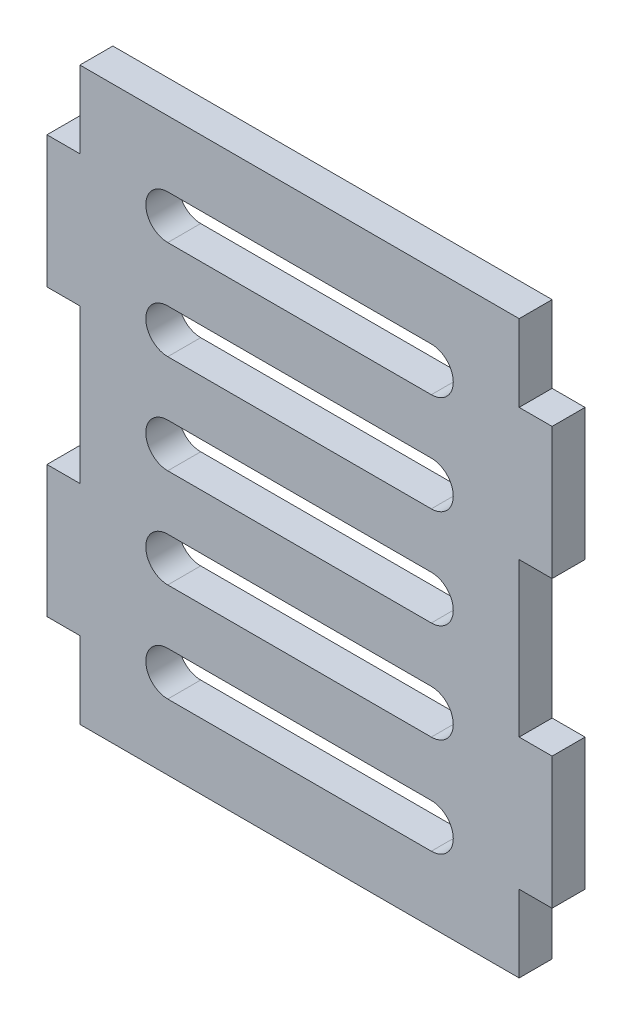
from build123d import *

# Parameters (mm, degrees)
SKETCH1_W        = 20
SKETCH1_H        = 26
BASE_DEPTH       = 1.5
SKETCH3_W        = 1.5
SKETCH3_H        = 6
MOUNT_EARS_DEPTH = 1.5
RIBS_REACH       = 47.875


with BuildPart() as part:
    # Sketch1 → Base (new body)
    with BuildSketch(Plane.XY):
        with Locations((10, 27.497191913)):
            Rectangle(SKETCH1_W, SKETCH1_H)
    extrude(amount=BASE_DEPTH)

    # Sketch3 → Mount ears (add)
    with BuildSketch(Plane.XY.offset(1.5)):
        with Locations((-0.75, 33.997191913)):
            Rectangle(SKETCH3_W, SKETCH3_H)
        with Locations((20.75, 33.997191913)):
            Rectangle(SKETCH3_W, SKETCH3_H)
        with Locations((20.75, 20.997191913)):
            Rectangle(SKETCH3_W, SKETCH3_H)
        with Locations((-0.75, 20.997191913)):
            Rectangle(SKETCH3_W, SKETCH3_H)
    extrude(amount=-MOUNT_EARS_DEPTH)

    # Sketch5 → Ribs (cut, up to next)
    with BuildSketch(Plane.XY.offset(1.5), mode=Mode.PRIVATE) as ribs_sk1:
        with BuildLine():
            Line((4, 37.497191913), (16, 37.497191913))
            ThreePointArc((16, 37.497191913), (17, 36.497191913), (16, 35.497191913))
            Line((16, 35.497191913), (4, 35.497191913))
            ThreePointArc((4, 35.497191913), (3, 36.497191913), (4, 37.497191913))
        make_face()
    ribs_tool1 = extrude(ribs_sk1.sketch, amount=-RIBS_REACH, mode=Mode.PRIVATE) & part.part
    # Sketch5 → Ribs (cut, up to next)
    with BuildSketch(Plane.XY.offset(1.5), mode=Mode.PRIVATE) as ribs_sk2:
        with BuildLine():
            Line((4, 32.997191913), (16, 32.997191913))
            ThreePointArc((16, 32.997191913), (17, 31.997191913), (16, 30.997191913))
            Line((16, 30.997191913), (4, 30.997191913))
            ThreePointArc((4, 30.997191913), (3, 31.997191913), (4, 32.997191913))
        make_face()
    ribs_tool2 = extrude(ribs_sk2.sketch, amount=-RIBS_REACH, mode=Mode.PRIVATE) & part.part
    # Sketch5 → Ribs (cut, up to next)
    with BuildSketch(Plane.XY.offset(1.5), mode=Mode.PRIVATE) as ribs_sk3:
        with BuildLine():
            Line((4, 28.497191913), (16, 28.497191913))
            ThreePointArc((16, 28.497191913), (17, 27.497191913), (16, 26.497191913))
            Line((16, 26.497191913), (4, 26.497191913))
            ThreePointArc((4, 26.497191913), (3, 27.497191913), (4, 28.497191913))
        make_face()
    ribs_tool3 = extrude(ribs_sk3.sketch, amount=-RIBS_REACH, mode=Mode.PRIVATE) & part.part
    # Sketch5 → Ribs (cut, up to next)
    with BuildSketch(Plane.XY.offset(1.5), mode=Mode.PRIVATE) as ribs_sk4:
        with BuildLine():
            Line((4, 23.997191913), (16, 23.997191913))
            ThreePointArc((16, 23.997191913), (17, 22.997191913), (16, 21.997191913))
            Line((16, 21.997191913), (4, 21.997191913))
            ThreePointArc((4, 21.997191913), (3, 22.997191913), (4, 23.997191913))
        make_face()
    ribs_tool4 = extrude(ribs_sk4.sketch, amount=-RIBS_REACH, mode=Mode.PRIVATE) & part.part
    # Sketch5 → Ribs (cut, up to next)
    with BuildSketch(Plane.XY.offset(1.5), mode=Mode.PRIVATE) as ribs_sk5:
        with BuildLine():
            Line((4, 19.497191913), (16, 19.497191913))
            ThreePointArc((16, 19.497191913), (17, 18.497191913), (16, 17.497191913))
            Line((16, 17.497191913), (4, 17.497191913))
            ThreePointArc((4, 17.497191913), (3, 18.497191913), (4, 19.497191913))
        make_face()
    ribs_tool5 = extrude(ribs_sk5.sketch, amount=-RIBS_REACH, mode=Mode.PRIVATE) & part.part
    add(ribs_tool1.solids().sort_by_distance((10, 36.497192, 1.5))[0], mode=Mode.SUBTRACT)
    add(ribs_tool2.solids().sort_by_distance((10, 31.997192, 1.5))[0], mode=Mode.SUBTRACT)
    add(ribs_tool3.solids().sort_by_distance((10, 27.497192, 1.5))[0], mode=Mode.SUBTRACT)
    add(ribs_tool4.solids().sort_by_distance((10, 22.997192, 1.5))[0], mode=Mode.SUBTRACT)
    add(ribs_tool5.solids().sort_by_distance((10, 18.497192, 1.5))[0], mode=Mode.SUBTRACT)


solid = part.part
